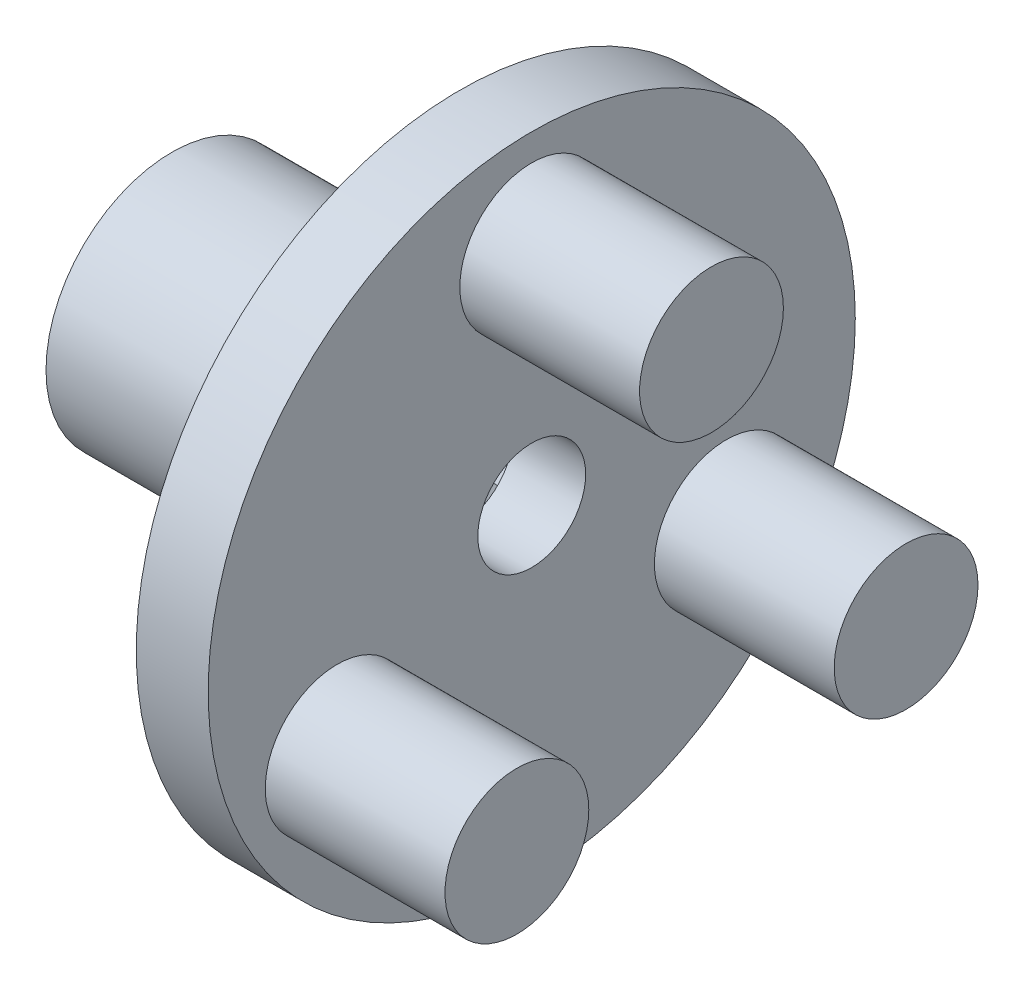
from build123d import *

# Parameters (mm, degrees)
SKETCH_1_R          = 9
EXTRUDE_1_DEPTH     = 2
EXTRUDE_START       = 2
SKETCH_1_3_R        = 2
EXTRUDE_2_DEPTH     = 5
SKETCH_2_R          = 5
SKETCH_2_R_2        = 1.5
EXTRUDE_3_DEPTH     = 0.01
SKETCH_3_R          = 3.5
SKETCH_3_R_2        = 2.6
EXTRUDE_4_DEPTH     = 8
CUT_EXTRUDE_1_REACH = 17.039
SKETCH_2_5_R        = 1.5


with BuildPart() as part:
    # 草图1 → 凸台-拉伸1 (new body)
    with BuildSketch(Plane(origin=(0, 0, 0), x_dir=(0, 0, -1), z_dir=(1, 0, 0))):
        Circle(SKETCH_1_R)
    extrude(amount=EXTRUDE_1_DEPTH)

    # 草图1<3> → 凸台-拉伸2 (add)
    with BuildSketch(Plane(origin=(0, 0, 0), x_dir=(0, 0, -1), z_dir=(1, 0, 0)).offset(EXTRUDE_START)):
        with Locations((0, 6.25)):
            Circle(SKETCH_1_3_R)
        with Locations((-5.412658774, -3.125)):
            Circle(SKETCH_1_3_R)
        with Locations((5.412658774, -3.125)):
            Circle(SKETCH_1_3_R)
    extrude(amount=EXTRUDE_2_DEPTH)

    # 草图2 → 凸台-拉伸3 (add)
    with BuildSketch(Plane.ZY):
        with Locations(Location((0, 0, 0), (0, 0, 180))):
            Circle(SKETCH_2_R)
        with Locations(Location((0, 0, 0), (0, 0, 180))):
            Circle(SKETCH_2_R_2, mode=Mode.SUBTRACT)
    extrude(amount=EXTRUDE_3_DEPTH)

    # 草图3 → 凸台-拉伸4 (add)
    # profile 1 of 5: a face of its own
    with BuildSketch(Plane.ZY.offset(0.01)):
        Circle(SKETCH_3_R)
        Circle(SKETCH_3_R_2, mode=Mode.SUBTRACT)
    # profile 2 of 5: a face of its own
    with BuildSketch(Plane.ZY.offset(0.01)):
        with BuildLine():
            ThreePointArc((-1.204280479, 2.304280479), (-1.838477631, 1.838477631), (-2.304280479, 1.204280479))
            Line((-2.304280479, 1.204280479), (-1.204280479, 1.204280479))
            Line((-1.204280479, 1.204280479), (-1.204280479, 2.304280479))
        make_face()
    # profile 3 of 5: a face of its own
    with BuildSketch(Plane.ZY.offset(0.01)):
        with BuildLine():
            Line((-1.204280479, -1.204280479), (-2.304280479, -1.204280479))
            ThreePointArc((-2.304280479, -1.204280479), (-1.838477631, -1.838477631), (-1.204280479, -2.304280479))
            Line((-1.204280479, -2.304280479), (-1.204280479, -1.204280479))
        make_face()
    # profile 4 of 5: a face of its own
    with BuildSketch(Plane.ZY.offset(0.01)):
        with BuildLine():
            Line((2.304280479, -1.204280479), (1.204280479, -1.204280479))
            Line((1.204280479, -1.204280479), (1.204280479, -2.304280479))
            ThreePointArc((1.204280479, -2.304280479), (1.838477631, -1.838477631), (2.304280479, -1.204280479))
        make_face()
    # profile 5 of 5: a face of its own
    with BuildSketch(Plane.ZY.offset(0.01)):
        with BuildLine():
            Line((1.204280479, 2.304280479), (1.204280479, 1.204280479))
            Line((1.204280479, 1.204280479), (2.304280479, 1.204280479))
            ThreePointArc((2.304280479, 1.204280479), (1.838477631, 1.838477631), (1.204280479, 2.304280479))
        make_face()
    extrude(amount=EXTRUDE_4_DEPTH)

    # 草图2<5> → 切除-拉伸1 (cut, up to next)
    with BuildSketch(Plane.ZY, mode=Mode.PRIVATE) as cut_extrude_1_sk1:
        with Locations(Location((0, 0, 0), (0, 0, 180))):
            Circle(SKETCH_2_5_R)
    cut_extrude_1_tool1 = extrude(cut_extrude_1_sk1.sketch, amount=-CUT_EXTRUDE_1_REACH, mode=Mode.PRIVATE) & part.part
    add(cut_extrude_1_tool1.solids().sort_by_distance((0, 0, 0))[0], mode=Mode.SUBTRACT)


solid = part.part
